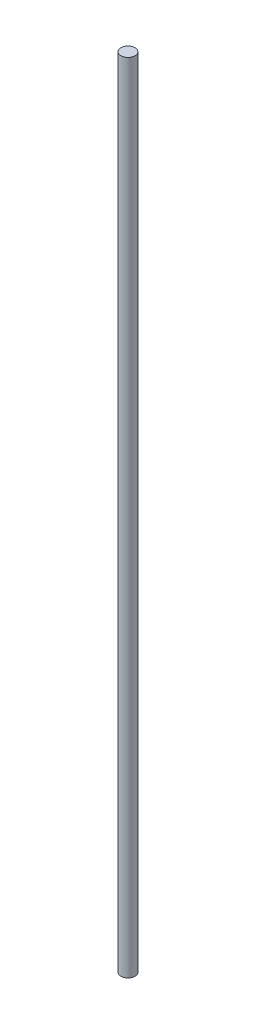
from build123d import *

# Parameters (mm, degrees)
SKETCH1_R           = 4
BOSS_EXTRUDE1_DEPTH = 454.9


with BuildPart() as part:
    # Sketch1 → Boss-Extrude1 (new body)
    with BuildSketch(Plane(origin=(0, 0, 0), x_dir=(1, 0, 0), z_dir=(0, 1, 0))):
        with Locations(Location((0, 0, 0), (0, 0, 270))):
            Circle(SKETCH1_R)
    extrude(amount=BOSS_EXTRUDE1_DEPTH)


solid = part.part
